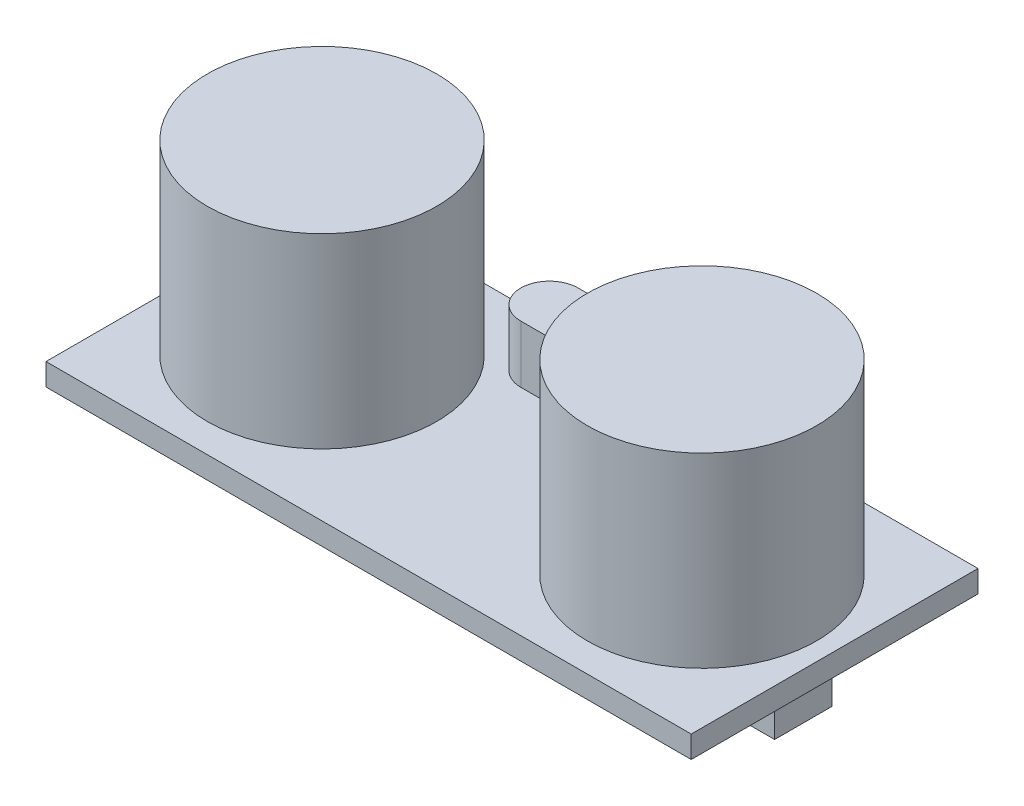
from build123d import *

# Parameters (mm, degrees)
SKETCH1_W           = 45
SKETCH1_H           = 20
BOSS_EXTRUDE1_DEPTH = 1.54
SKETCH2_R           = 8
BOSS_EXTRUDE2_DEPTH = 13
BOSS_EXTRUDE3_DEPTH = 4
SKETCH4_W           = 8.9
SKETCH4_H           = 4
SKETCH4_W_2         = 4
SKETCH4_H_2         = 8.9
BOSS_EXTRUDE4_DEPTH = 3.5


with BuildPart() as part:
    # Sketch1 → Boss-Extrude1 (new body)
    with BuildSketch(Plane(origin=(0, 0, 0), x_dir=(1, 0, 0), z_dir=(0, 1, 0))):
        Rectangle(SKETCH1_W, SKETCH1_H)
    extrude(amount=BOSS_EXTRUDE1_DEPTH)

    # Sketch2 → Boss-Extrude2 (add)
    with BuildSketch(Plane(origin=(0, 1.54, 0), x_dir=(1, 0, 0), z_dir=(0, 1, 0))):
        with Locations(Location((-13.25, 0, 0), (0, 0, 90))):
            Circle(SKETCH2_R)
        with Locations(Location((13.25, 0, 0), (0, 0, 90))):
            Circle(SKETCH2_R)
    extrude(amount=BOSS_EXTRUDE2_DEPTH)

    # Sketch3 → Boss-Extrude3 (add)
    with BuildSketch(Plane(origin=(0, 1.54, 0), x_dir=(1, 0, 0), z_dir=(0, 1, 0))):
        with BuildLine():
            Line((-4.3864516, 9), (4.3864516, 9))
            ThreePointArc((4.3864516, 9), (6.3864516, 7), (4.3864516, 5))
            Line((4.3864516, 5), (-4.3864516, 5))
            ThreePointArc((-4.3864516, 5), (-6.3864516, 7), (-4.3864516, 9))
        make_face()
    extrude(amount=BOSS_EXTRUDE3_DEPTH)

    # Sketch4 → Boss-Extrude4 (add)
    with BuildSketch(Plane(origin=(0, 0, 0), x_dir=(1, 0, 0), z_dir=(0, 1, 0))):
        Rectangle(SKETCH4_W, SKETCH4_H)
        with Locations((16.25, -0.384163824)):
            Rectangle(SKETCH4_W, SKETCH4_H)
        with Locations((-17.9, -1.55)):
            Rectangle(SKETCH4_W_2, SKETCH4_H_2)
    extrude(amount=-BOSS_EXTRUDE4_DEPTH)


solid = part.part
